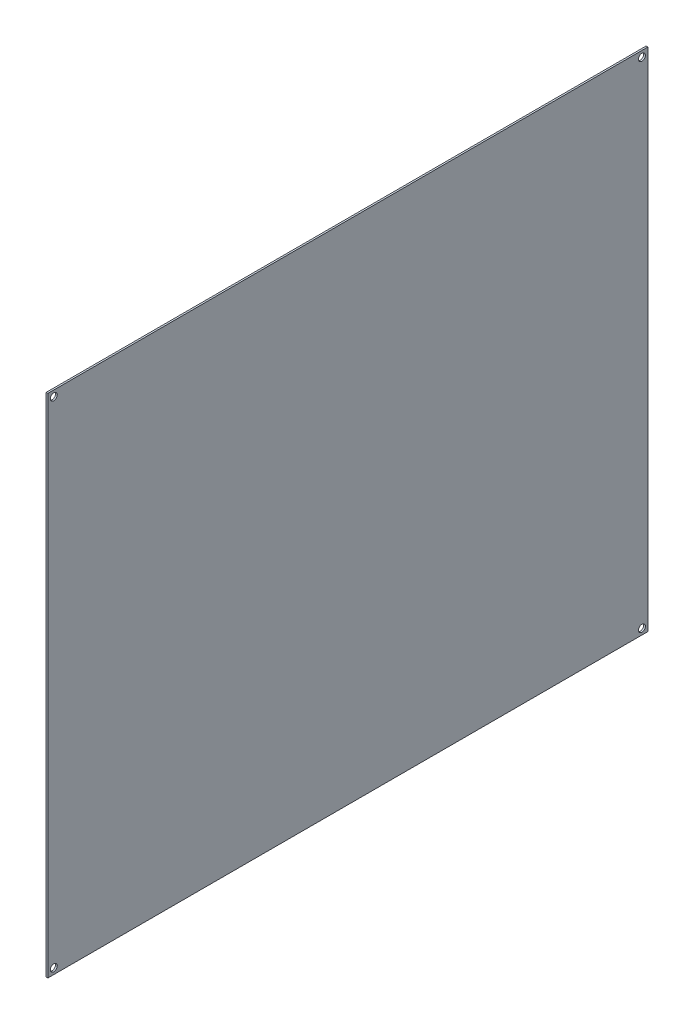
from build123d import *

# Parameters (mm, degrees)
SKETCH1_W           = 552.199999858
SKETCH1_H           = 466.00054246
SKETCH1_R           = 3.175
BOSS_EXTRUDE1_DEPTH = 1.6002


with BuildPart() as part:
    # Sketch1 → Boss-Extrude1 (new body)
    with BuildSketch(Plane.ZY.offset(873.127754017)):
        with Locations((-316.2, 273.100169628)):
            Rectangle(SKETCH1_W, SKETCH1_H)
        with Locations((-586.858968152, 500.658968)):
            Circle(SKETCH1_R, mode=Mode.SUBTRACT)
        with Locations((-45.541032, 500.658968)):
            Circle(SKETCH1_R, mode=Mode.SUBTRACT)
        with Locations((-45.541032, 45.541031777)):
            Circle(SKETCH1_R, mode=Mode.SUBTRACT)
        with Locations((-586.858968152, 45.541031777)):
            Circle(SKETCH1_R, mode=Mode.SUBTRACT)
    extrude(amount=BOSS_EXTRUDE1_DEPTH)


solid = part.part
